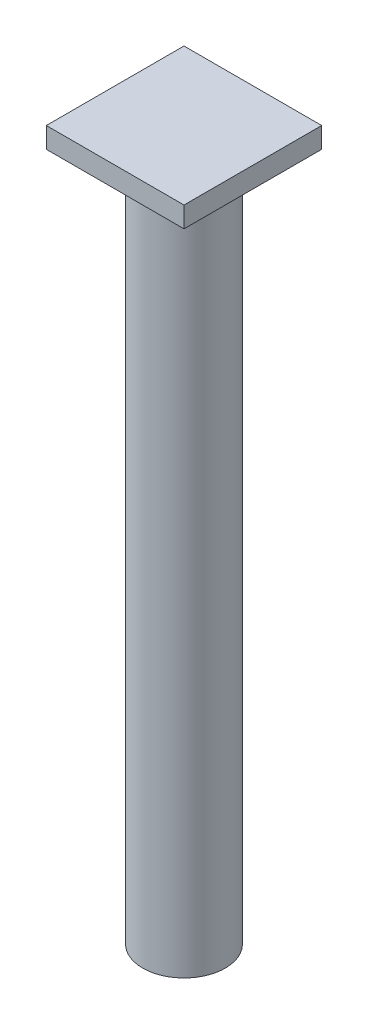
from build123d import *

# Parameters (mm, degrees)
SKETCH1_R           = 30
BOSS_EXTRUDE1_DEPTH = 500
SKETCH2_R           = 25
CUT_EXTRUDE1_DEPTH  = 100
SKETCH3_W           = 100
SKETCH3_H           = 100
BOSS_EXTRUDE2_DEPTH = 15


with BuildPart() as part:
    # Sketch1 → Boss-Extrude1 (new body)
    with BuildSketch(Plane(origin=(0, 0, 0), x_dir=(1, 0, 0), z_dir=(0, 1, 0))):
        with Locations(Location((0, 0, 0), (0, 0, 270))):
            Circle(SKETCH1_R)
    extrude(amount=BOSS_EXTRUDE1_DEPTH)

    # Sketch2 → Cut-Extrude1 (cut)
    with BuildSketch(Plane(origin=(0, 0, 0), x_dir=(-1, 0, 0), z_dir=(0, -1, 0))):
        with Locations(Location((0, 0, 0), (0, 0, 90))):
            Circle(SKETCH2_R)
    extrude(amount=-CUT_EXTRUDE1_DEPTH, mode=Mode.SUBTRACT)

    # Sketch3 → Boss-Extrude2 (add)
    with BuildSketch(Plane(origin=(0, 500, 0), x_dir=(1, 0, 0), z_dir=(0, 1, 0))):
        Rectangle(SKETCH3_W, SKETCH3_H)
    extrude(amount=BOSS_EXTRUDE2_DEPTH)


solid = part.part
